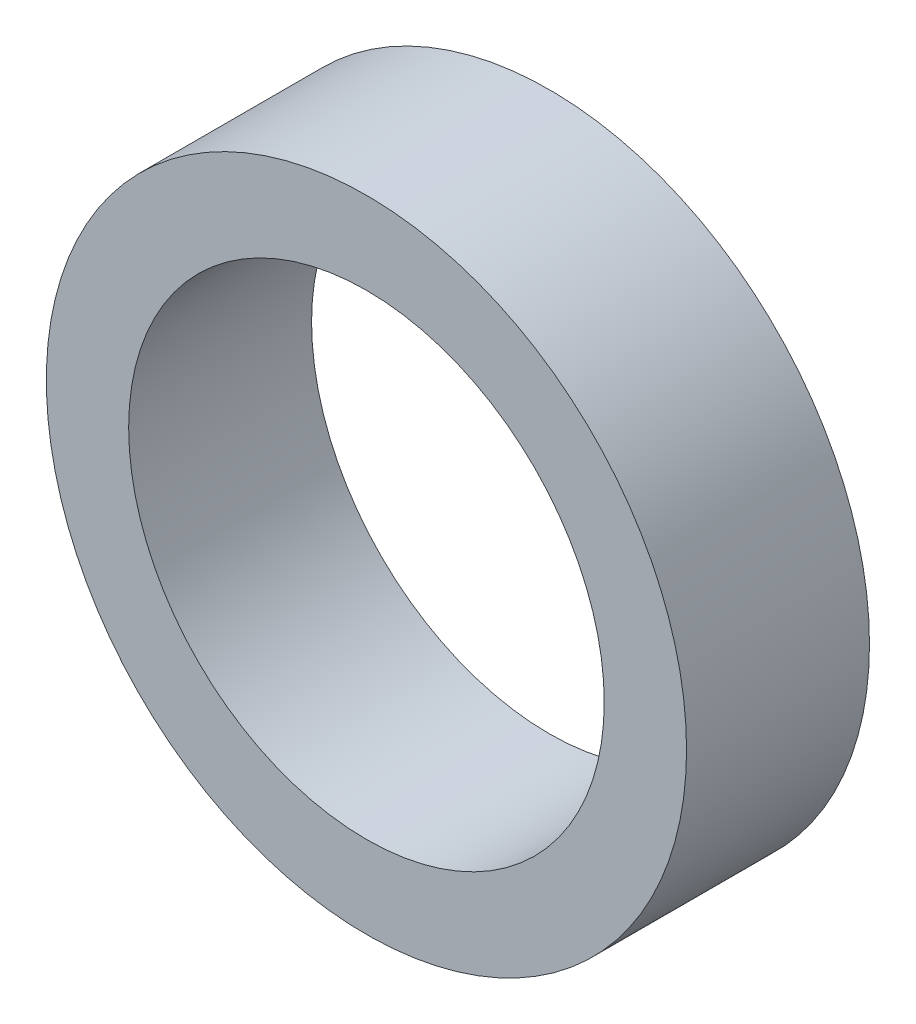
from build123d import *

# Parameters (mm, degrees)
SKETCH_1_R      = 3.5
SKETCH_1_R_2    = 2.6
EXTRUDE_1_DEPTH = 1


with BuildPart() as part:
    # Эскиз1 → Бобышка-Вытянуть1 (new, symmetric)
    with BuildSketch(Plane.XY):
        Circle(SKETCH_1_R)
        Circle(SKETCH_1_R_2, mode=Mode.SUBTRACT)
    extrude(amount=EXTRUDE_1_DEPTH, both=True)


solid = part.part
